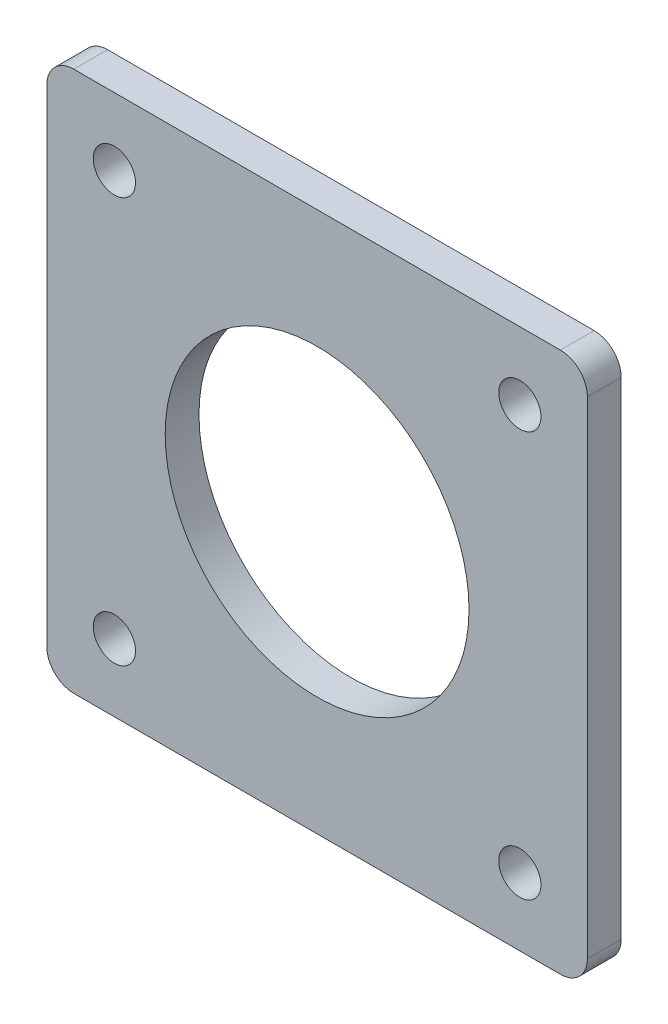
from build123d import *

# Parameters (mm, degrees)
SKETCH1_W                       = 50.8
SKETCH1_H                       = 50.8
SKETCH1_R                       = 14.2748
BOSS_EXTRUDE1_DEPTH             = 3.175
FILLET1_R                       = 2.54
F_5_32_0_15625_DIAMETER_HOLE1_D = 3.96875


with BuildPart() as part:
    # Sketch1 → Boss-Extrude1 (new body)
    with BuildSketch(Plane.XY):
        Rectangle(SKETCH1_W, SKETCH1_H)
        Circle(SKETCH1_R, mode=Mode.SUBTRACT)
    extrude(amount=BOSS_EXTRUDE1_DEPTH)

    # Fillet1
    fillet1_edges = [part.edges().sort_by_distance(p)[0] for p in [
        (-25.4, 25.4, 1.5875),
        (25.4, 25.4, 1.5875),
        (25.4, -25.4, 1.5875),
        (-25.4, -25.4, 1.5875),
    ]]
    fillet(fillet1_edges, radius=FILLET1_R)

    # 5/32 (0.15625) Diameter Hole1 (through all)
    with Locations(Plane.XY.offset(3.175)):
        with Locations((-19.05, 19.05), (19.05, 19.05), (19.05, -19.05), (-19.05, -19.05)):
            Hole(F_5_32_0_15625_DIAMETER_HOLE1_D / 2)


solid = part.part
